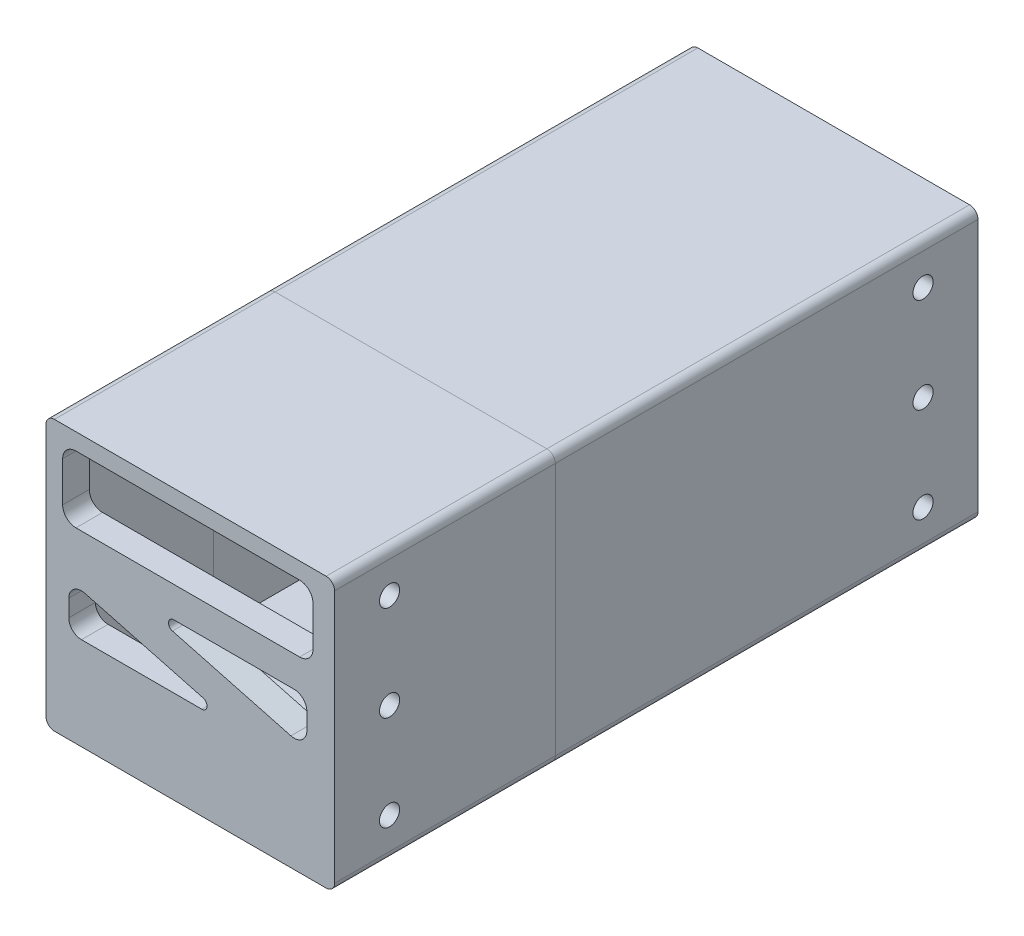
from build123d import *

# Parameters (mm, degrees)
SKETCH1_W            = 85.216
SKETCH1_H            = 81.152
BOSS_EXTRUDE1_DEPTH  = 185.308
SHELL2_T             = -4
SHELL3_T             = -4
SKETCH4_W            = 81.216
SKETCH4_H            = 77.152
SKETCH4_W_2          = 77.216
SKETCH4_H_2          = 73.152
BOSS_EXTRUDE2_DEPTH  = 20
SKETCH5_W            = 81.978
SKETCH5_H            = 77.914
SKETCH5_W_2          = 77.216
SKETCH5_H_2          = 73.152
CUT_EXTRUDE2_DEPTH   = 20
SKETCH6_W            = 75.216
SKETCH6_H            = 20
CUT_EXTRUDE3_DEPTH   = 4
FILLET3_R            = 4
SKETCH7_W            = 85.216
SKETCH7_H            = 81.152
BOSS_EXTRUDE3_DEPTH  = 4
SKETCH8_W            = 85.216
SKETCH8_H            = 81.152
BOSS_EXTRUDE4_DEPTH  = 4
SKETCH9_R            = 3.025
CUT_EXTRUDE4_DEPTH   = 6
SKETCH10_W           = 77.216
SKETCH10_H           = 73.152
BOSS_EXTRUDE5_DEPTH  = 4.500000096
CUT_EXTRUDE5_DEPTH   = 12.500000096
CUT_EXTRUDE6_DEPTH   = 8
SKETCH13_W           = 62.308
SKETCH13_H           = 81.152
BOSS_EXTRUDE7_DEPTH  = 1.5
SKETCH15_W           = 131
SKETCH15_H           = 81.152
BOSS_EXTRUDE8_DEPTH  = 1.5
FILLET4_R            = 2.54
FILLET5_R            = 2.54
SKETCH16_R           = 3.025
CUT_EXTRUDE9_DEPTH   = 19.5
SKETCH18_W           = 62.209478129
SKETCH18_H           = 16.943734599
BOSS_EXTRUDE9_DEPTH  = 8
SKETCH19_W           = 60.72535539
SKETCH19_H           = 14.841227386
BOSS_EXTRUDE10_DEPTH = 12.5
SKETCH20_W           = 81.216
SKETCH20_H           = 77.152
SKETCH20_W_2         = 77.216
SKETCH20_H_2         = 73.152
BOSS_EXTRUDE11_DEPTH = 20
SKETCH21_W           = 81.216
SKETCH21_H           = 77.152
CUT_EXTRUDE10_DEPTH  = 20


with BuildPart() as part:
    # Sketch1 → Boss-Extrude1 (new body)
    with BuildSketch(Plane.XY):
        Rectangle(SKETCH1_W, SKETCH1_H)
    extrude(amount=BOSS_EXTRUDE1_DEPTH)


with BuildPart() as body_2:
    # Split1: the piece on the far side of the plane
    add(part.part)
    split(bisect_by=Plane(origin=(0, 0, 127), x_dir=(-1, 0, 0), z_dir=(0, 0, -1)), keep=Keep.BOTTOM)

    # Shell3
    shell3_openings = [body_2.faces().sort_by_distance(p)[0] for p in [
        (0, 0, 127),
    ]]
    offset(amount=SHELL3_T, openings=shell3_openings, kind=Kind.INTERSECTION)

    # Sketch5 → Cut-Extrude2 (cut)
    with BuildSketch(Plane(origin=(0, 0, 127), x_dir=(-1, 0, 0), z_dir=(0, 0, -1))):
        Rectangle(SKETCH5_W, SKETCH5_H)
        Rectangle(SKETCH5_W_2, SKETCH5_H_2, mode=Mode.SUBTRACT)
    extrude(amount=-CUT_EXTRUDE2_DEPTH, mode=Mode.SUBTRACT)

    # Sketch6 → Cut-Extrude3 (cut)
    with BuildSketch(Plane.XY.offset(185.308)):
        with Locations((0, 25.576)):
            Rectangle(SKETCH6_W, SKETCH6_H)
    extrude(amount=-CUT_EXTRUDE3_DEPTH, mode=Mode.SUBTRACT)

    # Fillet3
    fillet3_edges = [body_2.edges().sort_by_distance(p)[0] for p in [
        (37.608, 35.576, 183.308),
        (37.608, 15.576, 183.308),
        (-37.608, 15.576, 183.308),
        (-37.608, 35.576, 183.308),
    ]]
    fillet(fillet3_edges, radius=FILLET3_R)

    # Sketch7 → Boss-Extrude3 (add)
    with BuildSketch(Plane.XY.offset(185.308)):
        Rectangle(SKETCH7_W, SKETCH7_H)
        with BuildLine():
            Line((-33.608, 15.576), (33.608, 15.576))
            ThreePointArc((33.608, 15.576), (36.436427125, 16.747572875), (37.608, 19.576))
            Line((37.608, 19.576), (37.608, 31.576))
            ThreePointArc((37.608, 31.576), (36.436427125, 34.404427125), (33.608, 35.576))
            Line((33.608, 35.576), (-33.608, 35.576))
            ThreePointArc((-33.608, 35.576), (-36.436427125, 34.404427125), (-37.608, 31.576))
            Line((-37.608, 31.576), (-37.608, 19.576))
            ThreePointArc((-37.608, 19.576), (-36.436427125, 16.747572875), (-33.608, 15.576))
        make_face(mode=Mode.SUBTRACT)
    extrude(amount=BOSS_EXTRUDE3_DEPTH)

    # Sketch9 → Cut-Extrude4 (cut)
    with BuildSketch(Plane.XY.offset(189.308)):
        with Locations((-21.304, -27.876)):
            Circle(SKETCH9_R)
        with Locations((0, -27.876)):
            Circle(SKETCH9_R)
        with Locations((21.304, -27.876)):
            Circle(SKETCH9_R)
    cut_extrude4 = extrude(amount=-CUT_EXTRUDE4_DEPTH, mode=Mode.SUBTRACT)

    # Sketch12 → Cut-Extrude6 (cut)
    with BuildSketch(Plane.XY.offset(189.308)):
        with BuildLine():
            Line((-30.972571902, -0.100195505), (4.615140384, -9.578475727))
            ThreePointArc((4.615140384, -9.578475727), (5.780649168, -11.318525139), (4.206574871, -12.7))
            Line((4.206574871, -12.7), (-31.953129133, -12.7))
            ThreePointArc((-31.953129133, -12.7), (-34.64720597, -11.584076836), (-35.763129133, -8.89))
            Line((-35.763129133, -8.89), (-35.763129133, -3.781853761))
            ThreePointArc((-35.763129133, -3.781853761), (-34.274785541, -0.760924844), (-30.972571902, -0.100195505))
        make_face()
        with BuildLine():
            Line((-4.206574871, 6.35), (31.953129133, 6.35))
            ThreePointArc((31.953129133, 6.35), (34.64720597, 5.234076836), (35.763129133, 2.54))
            Line((35.763129133, 2.54), (35.763129133, -2.568146239))
            ThreePointArc((35.763129133, -2.568146239), (34.274785541, -5.589075156), (30.972571902, -6.249804495))
            Line((30.972571902, -6.249804495), (-4.615140384, 3.228475727))
            ThreePointArc((-4.615140384, 3.228475727), (-5.780649168, 4.968525139), (-4.206574871, 6.35))
        make_face()
    extrude(amount=-CUT_EXTRUDE6_DEPTH, mode=Mode.SUBTRACT)


with BuildPart() as part_1:
    add(part.part)

    # Split1
    split(bisect_by=Plane(origin=(0, 0, 127), x_dir=(-1, 0, 0), z_dir=(0, 0, -1)), keep=Keep.TOP)

    # Shell2
    shell2_openings = [part_1.faces().sort_by_distance(p)[0] for p in [
        (0, 0, 127),
    ]]
    offset(amount=SHELL2_T, openings=shell2_openings, kind=Kind.INTERSECTION)

    # Sketch4 → Boss-Extrude2 (add)
    with BuildSketch(Plane.XY.offset(127)):
        Rectangle(SKETCH4_W, SKETCH4_H)
        Rectangle(SKETCH4_W_2, SKETCH4_H_2, mode=Mode.SUBTRACT)
    extrude(amount=BOSS_EXTRUDE2_DEPTH)

    # Sketch8 → Boss-Extrude4 (add)
    with BuildSketch(Plane(origin=(0, 0, 0), x_dir=(-1, 0, 0), z_dir=(0, 0, -1))):
        Rectangle(SKETCH8_W, SKETCH8_H)
    extrude(amount=BOSS_EXTRUDE4_DEPTH)

    # Mirror1: Cut-Extrude4 across plane
    add(cut_extrude4.mirror(Plane.XY.offset(92.654)), mode=Mode.SUBTRACT)

    # Sketch10 → Boss-Extrude5 (add)
    with BuildSketch(Plane.XY.offset(4)):
        Rectangle(SKETCH10_W, SKETCH10_H)
    extrude(amount=BOSS_EXTRUDE5_DEPTH)

    # Sketch11 → Cut-Extrude5 (cut)
    with BuildSketch(Plane(origin=(0, 0, -4), x_dir=(-1, 0, 0), z_dir=(0, 0, -1))):
        with BuildLine():
            ThreePointArc((29.908, 24.066), (28.792076836, 26.760076836), (26.098, 27.876))
            Line((26.098, 27.876), (11.727473696, 27.876))
            ThreePointArc((11.727473696, 27.876), (8.103904131, 25.243218589), (9.488243538, 20.983476959))
            Line((9.488243538, 20.983476959), (23.858769841, 10.544328421))
            ThreePointArc((23.858769841, 10.544328421), (27.827831364, 10.232181603), (29.908, 13.626851462))
            Line((29.908, 13.626851462), (29.908, 24.066))
        make_face()
        with BuildLine():
            ThreePointArc((-23.858769841, 1.819526927), (-27.827831364, 2.131673746), (-29.908, -1.262996113))
            Line((-29.908, -1.262996113), (-29.908, -11.766))
            ThreePointArc((-29.908, -11.766), (-28.792076836, -14.460076836), (-26.098, -15.576))
            Line((-26.098, -15.576), (-11.639570458, -15.576))
            ThreePointArc((-11.639570458, -15.576), (-8.016000893, -12.943218589), (-9.400340299, -8.683476959))
            Line((-9.400340299, -8.683476959), (-23.858769841, 1.819526927))
        make_face()
        with BuildLine():
            ThreePointArc((22.443899471, -18.002473668), (31.313488137, -16.596985531), (29.908, -7.727396865))
            Line((29.908, -7.727396865), (-22.443899471, 30.302473668))
            ThreePointArc((-22.443899471, 30.302473668), (-31.313488137, 28.896985531), (-29.908, 20.027396865))
            Line((-29.908, 20.027396865), (22.443899471, -18.002473668))
        make_face()
    extrude(amount=-CUT_EXTRUDE5_DEPTH, mode=Mode.SUBTRACT)

    add(body_2.part)  # Boss-Extrude7 merges body 2
    # Sketch13 → Boss-Extrude7 (add)
    with BuildSketch(Plane.ZY.offset(-42.608)):
        with Locations((158.154, 0)):
            Rectangle(SKETCH13_W, SKETCH13_H)
    extrude(amount=-BOSS_EXTRUDE7_DEPTH)

    # Sketch15 → Boss-Extrude8 (add)
    with BuildSketch(Plane(origin=(42.608, 0, 0), x_dir=(0, 0, -1), z_dir=(1, 0, 0))):
        with Locations((-61.5, 0)):
            Rectangle(SKETCH15_W, SKETCH15_H)
    extrude(amount=BOSS_EXTRUDE8_DEPTH)


with BuildPart() as body_2_2:
    # Split2: the piece on the far side of the plane
    add(part_1.part)
    split(bisect_by=Plane(origin=(0, 0, 123), x_dir=(-1, 0, 0), z_dir=(0, 0, -1)), keep=Keep.BOTTOM)

    # Fillet4
    fillet4_edges = [body_2_2.edges().sort_by_distance(p)[0] for p in [
        (44.108, -40.576, 156.154),
        (44.108, 40.576, 156.154),
        (-42.608, 40.576, 156.154),
        (-42.608, -40.576, 156.154),
    ]]
    fillet(fillet4_edges, radius=FILLET4_R)


with BuildPart() as part_2:
    add(part_1.part)

    # Split2
    split(bisect_by=Plane(origin=(0, 0, 123), x_dir=(-1, 0, 0), z_dir=(0, 0, -1)), keep=Keep.TOP)

    # Fillet5
    fillet5_edges = [part_2.edges().sort_by_distance(p)[0] for p in [
        (44.108, -40.576, 59.5),
        (44.108, 40.576, 59.5),
        (-42.608, 40.576, 59.5),
        (-42.608, -40.576, 59.5),
    ]]
    fillet(fillet5_edges, radius=FILLET5_R)


with BuildPart() as cut_extrude9_tool:
    # Sketch16 → Cut-Extrude9 (new body)
    with BuildSketch(Plane(origin=(44.108, 0, 0), x_dir=(0, 0, -1), z_dir=(1, 0, 0))):
        with Locations(Location((-172.798, 28.575, 0), (0, 0, 90))):
            Circle(SKETCH16_R)
        with Locations(Location((-172.798, 0, 0), (0, 0, 90))):
            Circle(SKETCH16_R)
        with Locations(Location((-172.798, -28.575, 0), (0, 0, 90))):
            Circle(SKETCH16_R)
        with Locations(Location((-12.51, 28.575, 0), (0, 0, 90))):
            Circle(SKETCH16_R)
        with Locations(Location((-12.51, 0, 0), (0, 0, 90))):
            Circle(SKETCH16_R)
        with Locations(Location((-12.51, -28.575, 0), (0, 0, 90))):
            Circle(SKETCH16_R)
    extrude(amount=-CUT_EXTRUDE9_DEPTH)


with BuildPart() as part_3:
    add(part_2.part)

    # Cut-Extrude9: cut by cut_extrude9_tool
    add(cut_extrude9_tool.part, mode=Mode.SUBTRACT)

    # Sketch19 → Boss-Extrude10 (add)
    with BuildSketch(Plane(origin=(0, 0, -4), x_dir=(-1, 0, 0), z_dir=(0, 0, -1))):
        with Locations((-1.053899817, -28.260170482)):
            Rectangle(SKETCH19_W, SKETCH19_H)
    extrude(amount=-BOSS_EXTRUDE10_DEPTH)

    # Sketch20 → Boss-Extrude11 (add)
    with BuildSketch(Plane.XY.offset(123)):
        Rectangle(SKETCH20_W, SKETCH20_H)
        Rectangle(SKETCH20_W_2, SKETCH20_H_2, mode=Mode.SUBTRACT)
    extrude(amount=BOSS_EXTRUDE11_DEPTH)


with BuildPart() as body_2_2_1:
    add(body_2_2.part)

    # Cut-Extrude9: cut by cut_extrude9_tool
    add(cut_extrude9_tool.part, mode=Mode.SUBTRACT)

    # Sketch18 → Boss-Extrude9 (add)
    with BuildSketch(Plane.XY.offset(189.308)):
        with Locations((0.188161552, -26.961563086)):
            Rectangle(SKETCH18_W, SKETCH18_H)
    extrude(amount=-BOSS_EXTRUDE9_DEPTH)

    # Sketch21 → Cut-Extrude10 (cut)
    with BuildSketch(Plane(origin=(0, 0, 123), x_dir=(-1, 0, 0), z_dir=(0, 0, -1))):
        Rectangle(SKETCH21_W, SKETCH21_H)
    extrude(amount=-CUT_EXTRUDE10_DEPTH, mode=Mode.SUBTRACT)


solid = Compound([part_3.part, body_2_2_1.part])
